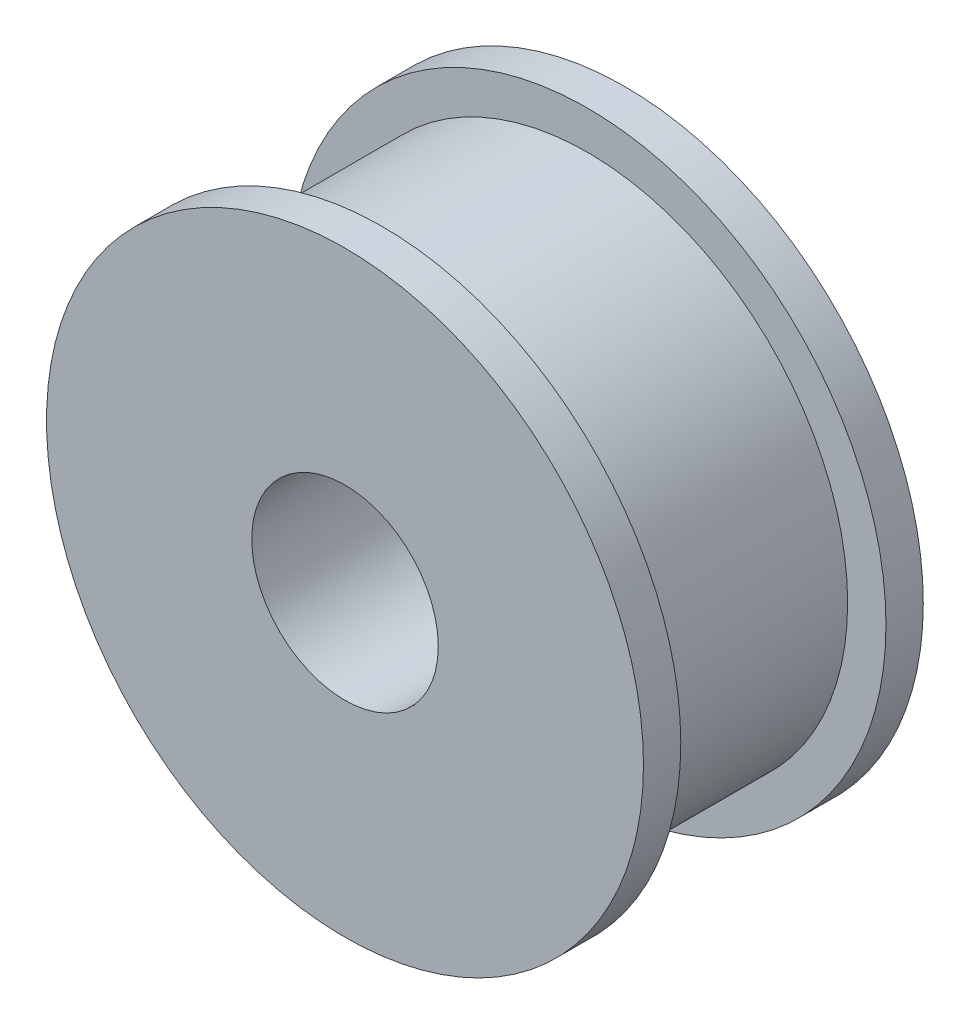
from build123d import *

# Parameters (mm, degrees)
SKETCH_1_R          = 16
EXTRUDE_1_DEPTH     = 2
SKETCH_2_R          = 13.945
EXTRUDE_2_DEPTH     = 11
SKETCH_3_R          = 16
EXTRUDE_3_DEPTH     = 2
SKETCH_4_R          = 5
CUT_EXTRUDE_1_DEPTH = 15


with BuildPart() as part:
    # 草图1 → 凸台-拉伸1 (new body)
    with BuildSketch(Plane.XY):
        Circle(SKETCH_1_R)
    extrude(amount=EXTRUDE_1_DEPTH)

    # 草图2 → 凸台-拉伸2 (add)
    with BuildSketch(Plane.XY.offset(2)):
        Circle(SKETCH_2_R)
    extrude(amount=EXTRUDE_2_DEPTH)

    # 草图3 → 凸台-拉伸3 (add)
    with BuildSketch(Plane.XY.offset(13)):
        Circle(SKETCH_3_R)
    extrude(amount=EXTRUDE_3_DEPTH)

    # 草图4 → 切除-拉伸1 (cut)
    with BuildSketch(Plane.XY.offset(15)):
        Circle(SKETCH_4_R)
    extrude(amount=-CUT_EXTRUDE_1_DEPTH, mode=Mode.SUBTRACT)


solid = part.part
